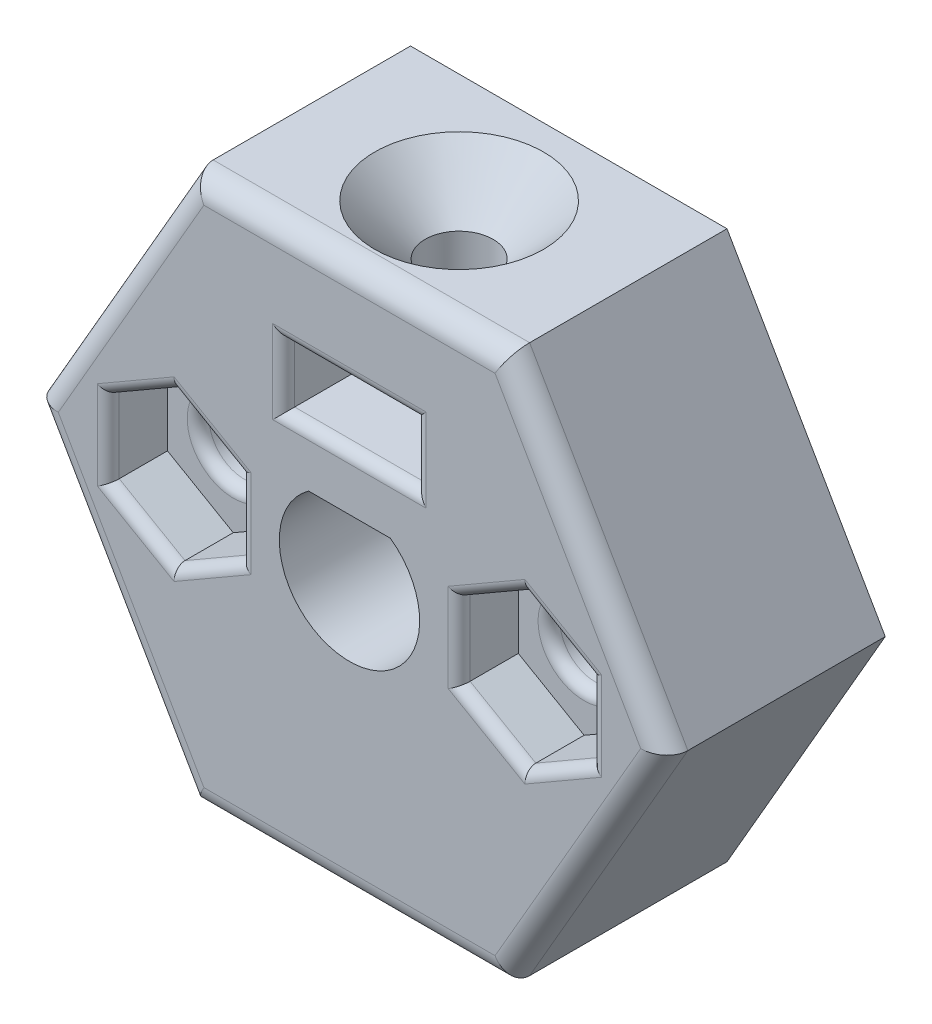
from build123d import *

# Parameters (mm, degrees)
EXTRUDE_1_DEPTH     = 10
CUT_EXTRUDE_1_DEPTH = 22.554195261
SKETCH_3_R          = 1.55
CUT_EXTRUDE_2_DEPTH = 9.9
CHAMFER_1_SIZE      = 2.3
SKETCH_4_W          = 6
SKETCH_4_H          = 2.8
CUT_EXTRUDE_3_DEPTH = 8.5
FILLET_1_R          = 1
CUT_EXTRUDE_4_DEPTH = 2.7
SKETCH_6_R          = 1.6
CUT_EXTRUDE_5_DEPTH = 7.3
FILLET_2_R          = 0.5


with BuildPart() as part:
    # Эскиз1 → Бобышка-Вытянуть1 (new body)
    with BuildSketch(Plane.XY):
        Polygon((7.216878365, -12.5), (14.43375673, 0), (7.216878365, 12.5), (-7.216878365, 12.5), (-14.43375673, 0), (-7.216878365, -12.5), align=None)
    extrude(amount=EXTRUDE_1_DEPTH)

    # Эскиз2 → Вырез-Вытянуть1 (cut, through all)
    with BuildSketch(Plane.XY.offset(10)):
        with BuildLine():
            Line((-1.865475811, 2.6), (1.865475811, 2.6))
            ThreePointArc((1.865475811, 2.6), (0, -3.2), (-1.865475811, 2.6))
        make_face()
    extrude(amount=-CUT_EXTRUDE_1_DEPTH, mode=Mode.SUBTRACT)

    # Эскиз3 → Вырез-Вытянуть2 (cut)
    with BuildSketch(Plane.XZ.offset(-2.6)):
        with Locations(Location((0, 5, 0), (0, 0, 270))):
            Circle(SKETCH_3_R)
    extrude(amount=-CUT_EXTRUDE_2_DEPTH, mode=Mode.SUBTRACT)

    # Фаска1
    chamfer_1_edges = [part.edges().sort_by_distance(p)[0] for p in [
        (0, 12.5, 6.55),
    ]]
    chamfer(chamfer_1_edges, length=CHAMFER_1_SIZE)

    # Эскиз4 → Вырез-Вытянуть3 (cut)
    with BuildSketch(Plane.XY.offset(10)):
        with Locations((0, 6.5)):
            Rectangle(SKETCH_4_W, SKETCH_4_H)
    extrude(amount=-CUT_EXTRUDE_3_DEPTH, mode=Mode.SUBTRACT)

    # Скругление1
    fillet_1_edges = [part.edges().sort_by_distance(p)[0] for p in [
        (10.825317547, 6.25, 10),
        (0, 12.5, 10),
        (-10.825317547, 6.25, 10),
        (-10.825317547, -6.25, 10),
        (0, -12.5, 10),
        (10.825317547, -6.25, 10),
    ]]
    fillet(fillet_1_edges, radius=FILLET_1_R)

    # Эскиз5 → Вырез-Вытянуть4 (cut)
    with BuildSketch(Plane.XY.offset(10)):
        Polygon((-11, -1.732050808), (-8, -3.464101615), (-5, -1.732050808), (-5, 1.732050808), (-8, 3.464101615), (-11, 1.732050808), align=None)
        Polygon((8, -3.464101615), (5, -1.732050808), (5, 1.732050808), (8, 3.464101615), (11, 1.732050808), (11, -1.732050808), align=None)
    extrude(amount=-CUT_EXTRUDE_4_DEPTH, mode=Mode.SUBTRACT)

    # Эскиз6 → Вырез-Вытянуть5 (cut)
    with BuildSketch(Plane.XY.offset(7.3)):
        with Locations((-8, 0)):
            Circle(SKETCH_6_R)
        with Locations((8, 0)):
            Circle(SKETCH_6_R)
    extrude(amount=-CUT_EXTRUDE_5_DEPTH, mode=Mode.SUBTRACT)

    # Скругление2
    fillet_2_edges = [part.edges().sort_by_distance(p)[0] for p in [
        (-9.6, 0, 7.3),
        (6.4, 0, 7.3),
        (3, 6.5, 10),
        (0, 7.9, 10),
        (-3, 6.5, 10),
        (0, 5.1, 10),
        (9.5, -2.598076211, 10),
        (11, 0, 10),
        (9.5, 2.598076211, 10),
        (6.5, 2.598076211, 10),
        (5, 0, 10),
        (6.5, -2.598076211, 10),
        (-11, 0, 10),
        (-9.5, -2.598076211, 10),
        (-6.5, -2.598076211, 10),
        (-5, 0, 10),
        (-6.5, 2.598076211, 10),
        (-9.5, 2.598076211, 10),
    ]]
    fillet(fillet_2_edges, radius=FILLET_2_R)


solid = part.part
